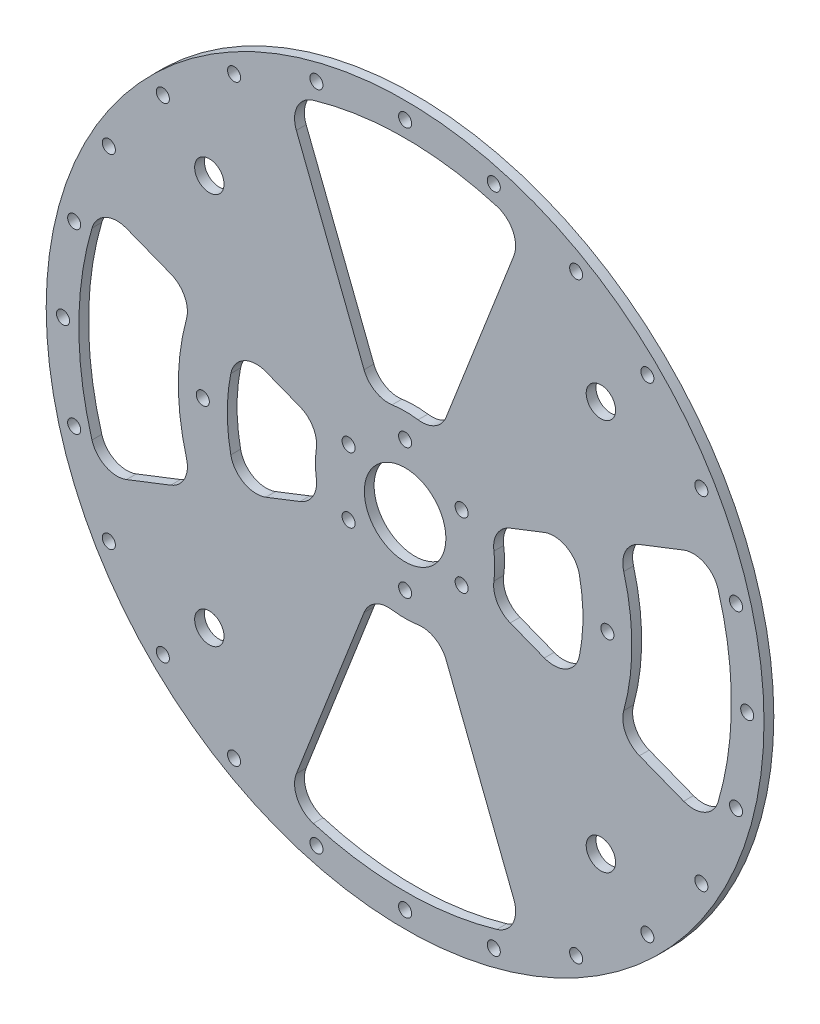
from build123d import *

# Parameters (mm, degrees)
SKETCH_1_R      = 110
SKETCH_1_R_2    = 2
SKETCH_1_R_3    = 4.5
SKETCH_1_R_4    = 12.5
EXTRUDE_1_DEPTH = 3


with BuildPart() as part:
    # 草图1 → 凸台-拉伸1 (new body)
    with BuildSketch(Plane.XY):
        Circle(SKETCH_1_R)
        with Locations((-74.246212025, -74.246212025)):
            Circle(SKETCH_1_R_2, mode=Mode.SUBTRACT)
        with Locations((-60, -60)):
            Circle(SKETCH_1_R_3, mode=Mode.SUBTRACT)
        with Locations((-52.42, -90.794103333)):
            Circle(SKETCH_1_R_2, mode=Mode.SUBTRACT)
        with Locations((-27.175999736, -101.42221176)):
            Circle(SKETCH_1_R_2, mode=Mode.SUBTRACT)
        with Locations((-90.794103333, -52.42)):
            Circle(SKETCH_1_R_2, mode=Mode.SUBTRACT)
        with Locations((-101.42221176, -27.175999736)):
            Circle(SKETCH_1_R_2, mode=Mode.SUBTRACT)
        with Locations((-104.84, 0)):
            Circle(SKETCH_1_R_2, mode=Mode.SUBTRACT)
        with Locations((0, -20)):
            Circle(SKETCH_1_R_2, mode=Mode.SUBTRACT)
        with Locations((-17.320508076, -10)):
            Circle(SKETCH_1_R_2, mode=Mode.SUBTRACT)
        with Locations((0, -104.84)):
            Circle(SKETCH_1_R_2, mode=Mode.SUBTRACT)
        with Locations((27.175999736, -101.42221176)):
            Circle(SKETCH_1_R_2, mode=Mode.SUBTRACT)
        with Locations((52.42, -90.794103333)):
            Circle(SKETCH_1_R_2, mode=Mode.SUBTRACT)
        with BuildLine():
            ThreePointArc((3.969843853, -27.211952149), (9.14743169, -28.213122771), (12.577035349, -32.219065502))
            Line((12.577035349, -32.219065502), (33.327823236, -85.377140959))
            ThreePointArc((33.327823236, -85.377140959), (33.055374747, -91.814593053), (28.125538485, -95.963295509))
            ThreePointArc((28.125538485, -95.963295509), (0, -100), (-28.125538485, -95.963295509))
            ThreePointArc((-28.125538485, -95.963295509), (-33.055374747, -91.814593053), (-33.327823236, -85.377140959))
            Line((-33.327823236, -85.377140959), (-12.577035349, -32.219065502))
            ThreePointArc((-12.577035349, -32.219065502), (-9.14743169, -28.213122771), (-3.969843853, -27.211952149))
            ThreePointArc((-3.969843853, -27.211952149), (0, -27.5), (3.969843853, -27.211952149))
        make_face(mode=Mode.SUBTRACT)
        with Locations((74.246212025, -74.246212025)):
            Circle(SKETCH_1_R_2, mode=Mode.SUBTRACT)
        with Locations((60, -60)):
            Circle(SKETCH_1_R_3, mode=Mode.SUBTRACT)
        with Locations((17.320508076, -10)):
            Circle(SKETCH_1_R_2, mode=Mode.SUBTRACT)
        with Locations((90.794103333, -52.42)):
            Circle(SKETCH_1_R_2, mode=Mode.SUBTRACT)
        with Locations((101.42221176, -27.175999736)):
            Circle(SKETCH_1_R_2, mode=Mode.SUBTRACT)
        with BuildLine():
            Line((-71.806959395, -28.030566765), (-85.377140959, -33.327823236))
            ThreePointArc((-85.377140959, -33.327823236), (-91.814593053, -33.055374747), (-95.963295509, -28.125538485))
            ThreePointArc((-95.963295509, -28.125538485), (-100, 0), (-95.963295509, 28.125538485))
            ThreePointArc((-95.963295509, 28.125538485), (-91.814593053, 33.055374747), (-85.377140959, 33.327823236))
            Line((-85.377140959, 33.327823236), (-71.806959395, 28.030566765))
            ThreePointArc((-71.806959395, 28.030566765), (-67.565247924, 24.16516315), (-67.003234476, 18.453980943))
            ThreePointArc((-67.003234476, 18.453980943), (-69.49807798, 0), (-67.003234476, -18.453980943))
            ThreePointArc((-67.003234476, -18.453980943), (-67.565247924, -24.16516315), (-71.806959395, -28.030566765))
        make_face(mode=Mode.SUBTRACT)
        with Locations((-101.42221176, 27.175999736)):
            Circle(SKETCH_1_R_2, mode=Mode.SUBTRACT)
        with Locations((-62, 0)):
            Circle(SKETCH_1_R_2, mode=Mode.SUBTRACT)
        with Locations((-90.794103333, 52.42)):
            Circle(SKETCH_1_R_2, mode=Mode.SUBTRACT)
        with BuildLine():
            ThreePointArc((-27.211952149, -3.969843853), (-28.213122771, -9.14743169), (-32.219065502, -12.577035349))
            Line((-32.219065502, -12.577035349), (-42.670779868, -16.656966874))
            ThreePointArc((-42.670779868, -16.656966874), (-49.413037015, -16.226521741), (-53.421568975, -10.788232859))
            ThreePointArc((-53.421568975, -10.788232859), (-54.5, 0), (-53.421568975, 10.788232859))
            ThreePointArc((-53.421568975, 10.788232859), (-49.413037015, 16.226521741), (-42.670779868, 16.656966874))
            Line((-42.670779868, 16.656966874), (-32.219065502, 12.577035349))
            ThreePointArc((-32.219065502, 12.577035349), (-28.213122771, 9.14743169), (-27.211952149, 3.969843853))
            ThreePointArc((-27.211952149, 3.969843853), (-27.5, 0), (-27.211952149, -3.969843853))
        make_face(mode=Mode.SUBTRACT)
        with Locations((-17.320508076, 10)):
            Circle(SKETCH_1_R_2, mode=Mode.SUBTRACT)
        with Locations((-60, 60)):
            Circle(SKETCH_1_R_3, mode=Mode.SUBTRACT)
        with Locations((-74.246212025, 74.246212025)):
            Circle(SKETCH_1_R_2, mode=Mode.SUBTRACT)
        with Locations((-52.42, 90.794103333)):
            Circle(SKETCH_1_R_2, mode=Mode.SUBTRACT)
        with Locations((-27.175999736, 101.42221176)):
            Circle(SKETCH_1_R_2, mode=Mode.SUBTRACT)
        Circle(SKETCH_1_R_4, mode=Mode.SUBTRACT)
        with Locations((17.320508076, 10)):
            Circle(SKETCH_1_R_2, mode=Mode.SUBTRACT)
        with Locations((0, 20)):
            Circle(SKETCH_1_R_2, mode=Mode.SUBTRACT)
        with BuildLine():
            ThreePointArc((27.211952149, 3.969843853), (28.213122771, 9.14743169), (32.219065502, 12.577035349))
            Line((32.219065502, 12.577035349), (42.670779868, 16.656966874))
            ThreePointArc((42.670779868, 16.656966874), (49.413037015, 16.226521741), (53.421568975, 10.788232859))
            ThreePointArc((53.421568975, 10.788232859), (54.5, 0), (53.421568975, -10.788232859))
            ThreePointArc((53.421568975, -10.788232859), (49.413037015, -16.226521741), (42.670779868, -16.656966874))
            Line((42.670779868, -16.656966874), (32.219065502, -12.577035349))
            ThreePointArc((32.219065502, -12.577035349), (28.213122771, -9.14743169), (27.211952149, -3.969843853))
            ThreePointArc((27.211952149, -3.969843853), (27.5, 0), (27.211952149, 3.969843853))
        make_face(mode=Mode.SUBTRACT)
        with Locations((62, 0)):
            Circle(SKETCH_1_R_2, mode=Mode.SUBTRACT)
        with BuildLine():
            ThreePointArc((95.963295509, -28.125538485), (91.814593053, -33.055374747), (85.377140959, -33.327823236))
            Line((85.377140959, -33.327823236), (71.806959395, -28.030566765))
            ThreePointArc((71.806959395, -28.030566765), (67.565247924, -24.16516315), (67.003234476, -18.453980943))
            ThreePointArc((67.003234476, -18.453980943), (69.49807798, 0), (67.003234476, 18.453980943))
            ThreePointArc((67.003234476, 18.453980943), (67.565247924, 24.16516315), (71.806959395, 28.030566765))
            Line((71.806959395, 28.030566765), (85.377140959, 33.327823236))
            ThreePointArc((85.377140959, 33.327823236), (91.814593053, 33.055374747), (95.963295509, 28.125538485))
            ThreePointArc((95.963295509, 28.125538485), (100, 0), (95.963295509, -28.125538485))
        make_face(mode=Mode.SUBTRACT)
        with Locations((104.84, 0)):
            Circle(SKETCH_1_R_2, mode=Mode.SUBTRACT)
        with Locations((101.42221176, 27.175999736)):
            Circle(SKETCH_1_R_2, mode=Mode.SUBTRACT)
        with Locations((90.794103333, 52.42)):
            Circle(SKETCH_1_R_2, mode=Mode.SUBTRACT)
        with BuildLine():
            Line((33.327823236, 85.377140959), (12.577035349, 32.219065502))
            ThreePointArc((12.577035349, 32.219065502), (9.14743169, 28.213122771), (3.969843853, 27.211952149))
            ThreePointArc((3.969843853, 27.211952149), (0, 27.5), (-3.969843853, 27.211952149))
            ThreePointArc((-3.969843853, 27.211952149), (-9.14743169, 28.213122771), (-12.577035349, 32.219065502))
            Line((-12.577035349, 32.219065502), (-33.327823236, 85.377140959))
            ThreePointArc((-33.327823236, 85.377140959), (-33.055374747, 91.814593053), (-28.125538485, 95.963295509))
            ThreePointArc((-28.125538485, 95.963295509), (0, 100), (28.125538485, 95.963295509))
            ThreePointArc((28.125538485, 95.963295509), (33.055374747, 91.814593053), (33.327823236, 85.377140959))
        make_face(mode=Mode.SUBTRACT)
        with Locations((0, 104.84)):
            Circle(SKETCH_1_R_2, mode=Mode.SUBTRACT)
        with Locations((27.175999736, 101.42221176)):
            Circle(SKETCH_1_R_2, mode=Mode.SUBTRACT)
        with Locations((52.42, 90.794103333)):
            Circle(SKETCH_1_R_2, mode=Mode.SUBTRACT)
        with Locations((60, 60)):
            Circle(SKETCH_1_R_3, mode=Mode.SUBTRACT)
        with Locations((74.246212025, 74.246212025)):
            Circle(SKETCH_1_R_2, mode=Mode.SUBTRACT)
    extrude(amount=EXTRUDE_1_DEPTH)


solid = part.part
